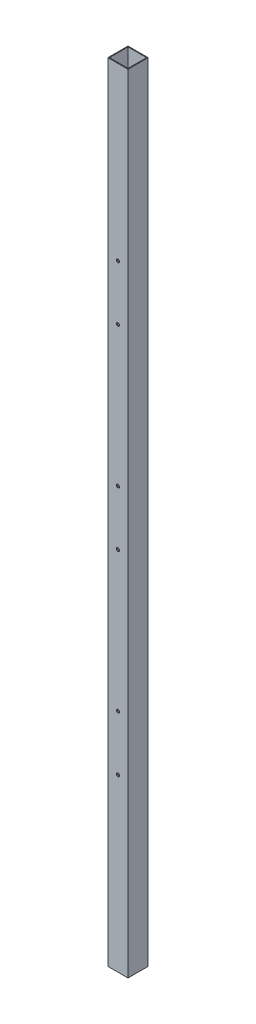
from build123d import *

# Parameters (mm, degrees)
SKETCH1_W           = 25.6
SKETCH1_H           = 25.6
SKETCH1_W_2         = 23.6
SKETCH1_H_2         = 23.6
BOSS_EXTRUDE1_DEPTH = 1000
SKETCH2_R           = 2
CUT_EXTRUDE1_DEPTH  = 33


with BuildPart() as part:
    # Sketch1 → Boss-Extrude1 (new body)
    with BuildSketch(Plane(origin=(0, 0, 0), x_dir=(1, 0, 0), z_dir=(0, 1, 0))):
        Rectangle(SKETCH1_W, SKETCH1_H)
        Rectangle(SKETCH1_W_2, SKETCH1_H_2, mode=Mode.SUBTRACT)
    extrude(amount=BOSS_EXTRUDE1_DEPTH)

    # Sketch2 → Cut-Extrude1 (cut)
    with BuildSketch(Plane(origin=(0, 0, -12.8), x_dir=(-1, 0, 0), z_dir=(0, 0, -1))):
        with Locations((0, 535)):
            Circle(SKETCH2_R)
        with Locations((0, 465)):
            Circle(SKETCH2_R)
        with Locations((0, 782.8)):
            Circle(SKETCH2_R)
        with Locations((0, 712.8)):
            Circle(SKETCH2_R)
        with Locations(Location((0, 287.2, 0), (0, 0, 180))):
            Circle(SKETCH2_R)
        with Locations(Location((0, 217.2, 0), (0, 0, 180))):
            Circle(SKETCH2_R)
    extrude(amount=-CUT_EXTRUDE1_DEPTH, mode=Mode.SUBTRACT)


solid = part.part
